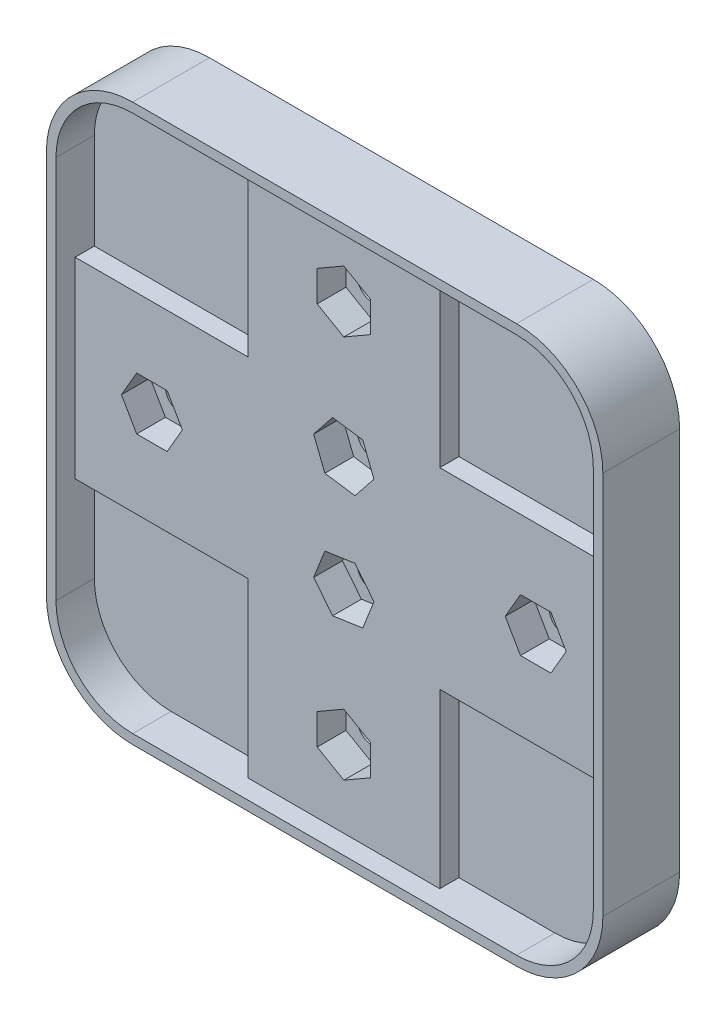
from build123d import *

# Parameters (mm, degrees)
EXTRUDE_1_DEPTH     = 4
EXTRUDE_START       = 2
EXTRUDE_2_DEPTH     = 2
EXTRUDE_3_DEPTH     = 2
SKETCH_4_R          = 1.6
CUT_EXTRUDE_1_DEPTH = 10
CUT_EXTRUDE_2_DEPTH = 3
SKETCH_7_R          = 1.6
CUT_EXTRUDE_3_DEPTH = 10
CUT_EXTRUDE_4_DEPTH = 3


with BuildPart() as part:
    # 草图1 → 凸台-拉伸1 (new body)
    with BuildSketch(Plane.XY):
        with BuildLine():
            Line((-35.40625, 64.537081934), (4.59375, 64.537081934))
            ThreePointArc((4.59375, 64.537081934), (10.957711031, 61.901042965), (13.59375, 55.537081934))
            Line((13.59375, 55.537081934), (13.59375, 15.537081934))
            ThreePointArc((13.59375, 15.537081934), (10.957711031, 9.173120903), (4.59375, 6.537081934))
            Line((4.59375, 6.537081934), (-35.40625, 6.537081934))
            ThreePointArc((-35.40625, 6.537081934), (-41.770211031, 9.173120903), (-44.40625, 15.537081934))
            Line((-44.40625, 15.537081934), (-44.40625, 55.537081934))
            ThreePointArc((-44.40625, 55.537081934), (-41.770211031, 61.901042965), (-35.40625, 64.537081934))
        make_face()
    extrude(amount=-EXTRUDE_1_DEPTH)

    # 草图2 → 凸台-拉伸2 (add)
    with BuildSketch(Plane.XY.offset(EXTRUDE_START)):
        with BuildLine():
            Line((13.59375, 15.537081934), (13.59375, 55.537081934))
            ThreePointArc((13.59375, 55.537081934), (10.957711031, 61.901042965), (4.59375, 64.537081934))
            Line((4.59375, 64.537081934), (-35.40625, 64.537081934))
            ThreePointArc((-35.40625, 64.537081934), (-41.770211031, 61.901042965), (-44.40625, 55.537081934))
            Line((-44.40625, 55.537081934), (-44.40625, 15.537081934))
            ThreePointArc((-44.40625, 15.537081934), (-41.770211031, 9.173120903), (-35.40625, 6.537081934))
            Line((-35.40625, 6.537081934), (4.59375, 6.537081934))
            ThreePointArc((4.59375, 6.537081934), (10.957711031, 9.173120903), (13.59375, 15.537081934))
        make_face()
        with BuildLine():
            Line((-35.40625, 63.537081934), (-25.40625, 63.537081934))
            Line((-25.40625, 63.537081934), (-25.40625, 45.537081934))
            Line((-25.40625, 45.537081934), (-43.40625, 45.537081934))
            Line((-43.40625, 45.537081934), (-43.40625, 55.537081934))
            ThreePointArc((-43.40625, 55.537081934), (-41.063104249, 61.193936184), (-35.40625, 63.537081934))
        make_face(mode=Mode.SUBTRACT)
        with BuildLine():
            Line((12.59375, 55.537081934), (12.59375, 45.537081934))
            Line((12.59375, 45.537081934), (-5.40625, 45.537081934))
            Line((-5.40625, 45.537081934), (-5.40625, 63.537081934))
            Line((-5.40625, 63.537081934), (4.59375, 63.537081934))
            ThreePointArc((4.59375, 63.537081934), (10.250604249, 61.193936184), (12.59375, 55.537081934))
        make_face(mode=Mode.SUBTRACT)
        with BuildLine():
            Line((-35.40625, 7.537081934), (-25.40625, 7.537081934))
            Line((-25.40625, 7.537081934), (-25.40625, 25.537081934))
            Line((-25.40625, 25.537081934), (-43.40625, 25.537081934))
            Line((-43.40625, 25.537081934), (-43.40625, 15.537081934))
            ThreePointArc((-43.40625, 15.537081934), (-41.063104249, 9.880227685), (-35.40625, 7.537081934))
        make_face(mode=Mode.SUBTRACT)
        with BuildLine():
            Line((-5.40625, 25.537081934), (12.59375, 25.537081934))
            Line((12.59375, 25.537081934), (12.59375, 15.537081934))
            ThreePointArc((12.59375, 15.537081934), (10.250604249, 9.880227685), (4.59375, 7.537081934))
            Line((4.59375, 7.537081934), (-5.40625, 7.537081934))
            Line((-5.40625, 7.537081934), (-5.40625, 25.537081934))
        make_face(mode=Mode.SUBTRACT)
    extrude(amount=-EXTRUDE_2_DEPTH)

    # 草图3 → 凸台-拉伸3 (add)
    with BuildSketch(Plane.XY.offset(2).offset(EXTRUDE_START)):
        with BuildLine():
            Line((13.59375, 15.537081934), (13.59375, 55.537081934))
            ThreePointArc((13.59375, 55.537081934), (10.957711031, 61.901042965), (4.59375, 64.537081934))
            Line((4.59375, 64.537081934), (-35.40625, 64.537081934))
            ThreePointArc((-35.40625, 64.537081934), (-41.770211031, 61.901042965), (-44.40625, 55.537081934))
            Line((-44.40625, 55.537081934), (-44.40625, 15.537081934))
            ThreePointArc((-44.40625, 15.537081934), (-41.770211031, 9.173120903), (-35.40625, 6.537081934))
            Line((-35.40625, 6.537081934), (4.59375, 6.537081934))
            ThreePointArc((4.59375, 6.537081934), (10.957711031, 9.173120903), (13.59375, 15.537081934))
        make_face()
        with BuildLine():
            Line((-43.40625, 55.537081934), (-43.40625, 45.537081934))
            Line((-43.40625, 45.537081934), (-43.40625, 25.537081934))
            Line((-43.40625, 25.537081934), (-43.40625, 15.537081934))
            ThreePointArc((-43.40625, 15.537081934), (-41.063104249, 9.880227685), (-35.40625, 7.537081934))
            Line((-35.40625, 7.537081934), (-25.40625, 7.537081934))
            Line((-25.40625, 7.537081934), (-5.40625, 7.537081934))
            Line((-5.40625, 7.537081934), (4.59375, 7.537081934))
            ThreePointArc((4.59375, 7.537081934), (10.250604249, 9.880227685), (12.59375, 15.537081934))
            Line((12.59375, 15.537081934), (12.59375, 25.537081934))
            Line((12.59375, 25.537081934), (12.59375, 45.537081934))
            Line((12.59375, 45.537081934), (12.59375, 55.537081934))
            ThreePointArc((12.59375, 55.537081934), (10.250604249, 61.193936184), (4.59375, 63.537081934))
            Line((4.59375, 63.537081934), (-5.40625, 63.537081934))
            Line((-5.40625, 63.537081934), (-25.40625, 63.537081934))
            Line((-25.40625, 63.537081934), (-35.40625, 63.537081934))
            ThreePointArc((-35.40625, 63.537081934), (-41.063104249, 61.193936184), (-43.40625, 55.537081934))
        make_face(mode=Mode.SUBTRACT)
    extrude(amount=-EXTRUDE_3_DEPTH)

    # 草图4 → 切除-拉伸1 (cut)
    with BuildSketch(Plane.XY.offset(2)):
        with Locations((-15.40625, 41.537081934)):
            Circle(SKETCH_4_R)
        with Locations((-15.40625, 29.537081934)):
            Circle(SKETCH_4_R)
        with Locations((4.59375, 35.537081934)):
            Circle(SKETCH_4_R)
        with Locations((-35.40625, 35.537081934)):
            Circle(SKETCH_4_R)
    extrude(amount=-CUT_EXTRUDE_1_DEPTH, mode=Mode.SUBTRACT)

    # 草图5 → 切除-拉伸2 (cut)
    with BuildSketch(Plane.XY.offset(2)):
        Polygon((-13.431907117, 44.024108978), (-16.572907158, 44.490426548), (-18.547250041, 42.003399505), (-17.380592883, 39.050054891), (-14.239592842, 38.58373732), (-12.265249959, 41.070764364), align=None)
        Polygon((1.418323519, 35.537081934), (3.00603676, 32.787081934), (6.18146324, 32.787081934), (7.769176481, 35.537081934), (6.18146324, 38.287081934), (3.00603676, 38.287081934), align=None)
        Polygon((-13.431907117, 27.050054891), (-12.265249959, 30.003399505), (-14.239592842, 32.490426548), (-17.380592883, 32.024108978), (-18.547250041, 29.070764364), (-16.572907158, 26.58373732), align=None)
        Polygon((-32.230823519, 35.537081934), (-33.81853676, 38.287081934), (-36.99396324, 38.287081934), (-38.581676481, 35.537081934), (-36.99396324, 32.787081934), (-33.81853676, 32.787081934), align=None)
    extrude(amount=-CUT_EXTRUDE_2_DEPTH, mode=Mode.SUBTRACT)

    # 草图7 → 切除-拉伸3 (cut)
    with BuildSketch(Plane.XY.offset(2)):
        with Locations((-15.40625, 15.537081934)):
            Circle(SKETCH_7_R)
        with Locations((-15.40625, 55.537081934)):
            Circle(SKETCH_7_R)
    extrude(amount=-CUT_EXTRUDE_3_DEPTH, mode=Mode.SUBTRACT)

    # 草图8 → 切除-拉伸4 (cut)
    with BuildSketch(Plane.XY.offset(2)):
        Polygon((-15.40625, 18.741375928), (-18.18125, 17.139228931), (-18.18125, 13.934934937), (-15.40625, 12.33278794), (-12.63125, 13.934934937), (-12.63125, 17.139228931), align=None)
        Polygon((-15.40625, 58.741375928), (-18.18125, 57.139228931), (-18.18125, 53.934934937), (-15.40625, 52.33278794), (-12.63125, 53.934934937), (-12.63125, 57.139228931), align=None)
    extrude(amount=-CUT_EXTRUDE_4_DEPTH, mode=Mode.SUBTRACT)


solid = part.part
